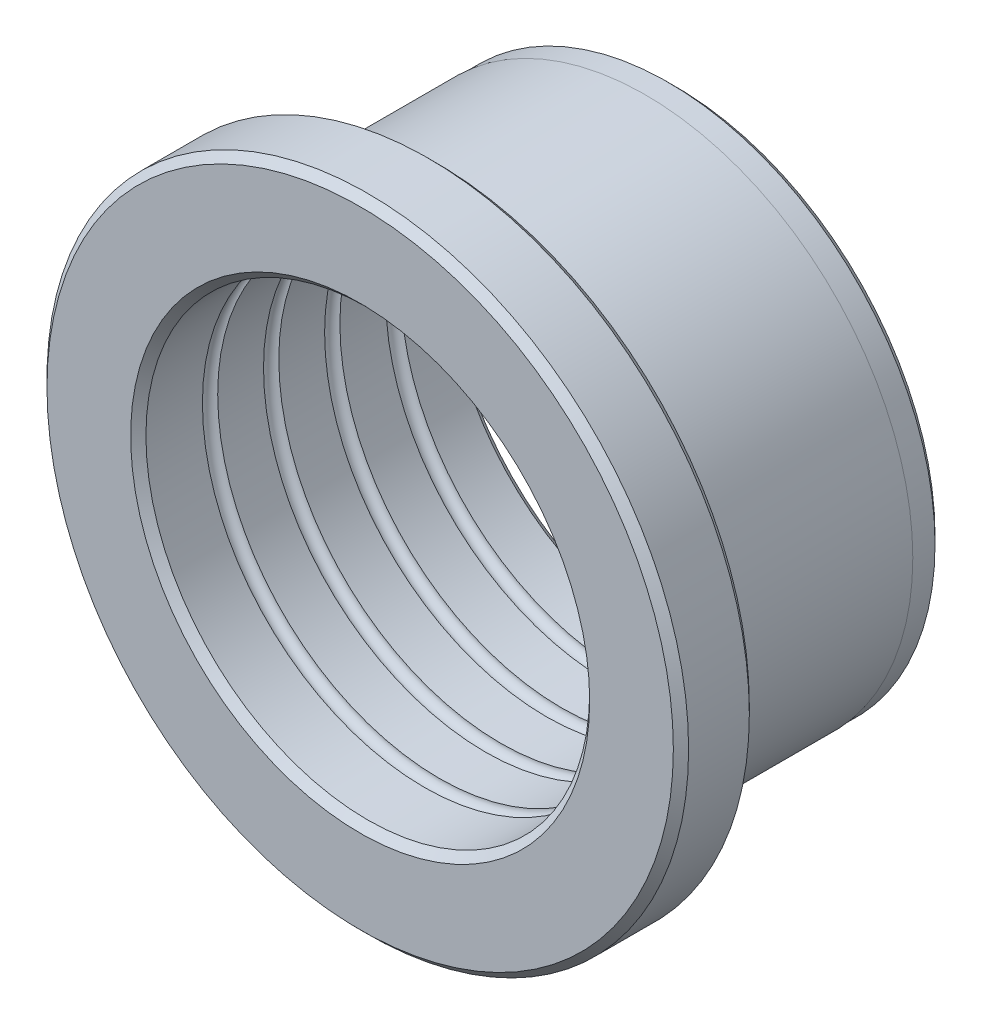
from build123d import *


with BuildPart() as part:
    # Sketch1 → Revolve1 (revolve)
    with BuildSketch(Plane(origin=(0, 0, 0), x_dir=(0, 0, -1), z_dir=(1, 0, 0)), mode=Mode.PRIVATE) as revolve1_sk:
        with BuildLine():
            Line((0.5, 14.5275), (4.20000625, 14.5275))
            ThreePointArc((4.20000625, 14.5275), (4.7, 15.025), (5.19999375, 14.5275))
            Line((5.19999375, 14.5275), (8.20000625, 14.5275))
            ThreePointArc((8.20000625, 14.5275), (8.7, 15.025), (9.19999375, 14.5275))
            Line((9.19999375, 14.5275), (12.20000625, 14.5275))
            ThreePointArc((12.20000625, 14.5275), (12.7, 15.025), (13.19999375, 14.5275))
            Line((13.19999375, 14.5275), (16.20000625, 14.5275))
            ThreePointArc((16.20000625, 14.5275), (16.7, 15.025), (17.19999375, 14.5275))
            Line((17.19999375, 14.5275), (20.175, 14.5275))
            Line((20.175, 14.5275), (20.675, 15.0275))
            Line((20.675, 15.0275), (20.675, 16.9625))
            Line((20.675, 16.9625), (20.175, 17.4625))
            Line((20.175, 17.4625), (18.675, 17.4625))
            Line((18.675, 17.4625), (18.675, 17.5075))
            Line((18.675, 17.5075), (5.375, 17.5075))
            ThreePointArc((5.375, 17.5075), (5.092157288, 17.624657288), (4.975, 17.9075))
            Line((4.975, 17.9075), (4.975, 20.505))
            Line((4.975, 20.505), (4.475, 21.005))
            Line((4.475, 21.005), (0.5, 21.005))
            Line((0.5, 21.005), (0, 20.505))
            Line((0, 20.505), (0, 15.0275))
            Line((0, 15.0275), (0.5, 14.5275))
        make_face()
    revolve(revolve1_sk.sketch.rotate(Axis((0, 0, 0), (0, 0, -1)), 90), axis=Axis((0, 0, 0), (0, 0, -1)))


solid = part.part
